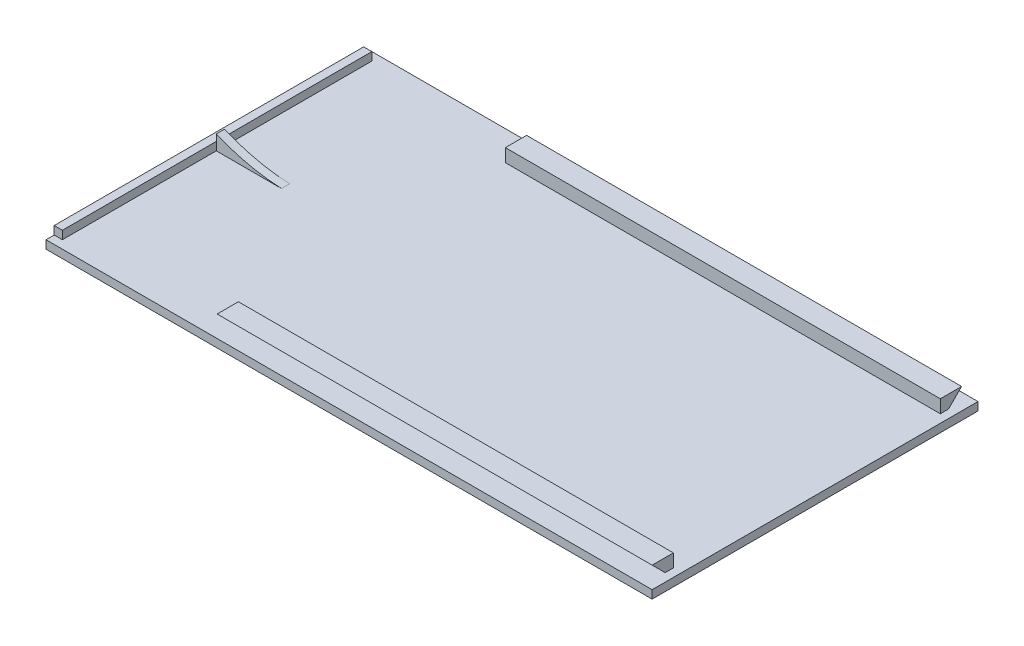
from build123d import *

# Parameters (mm, degrees)
ESBO_O1_W                = 93
ESBO_O1_H                = 50
RESSALTO_EXTRUS_O1_DEPTH = 1.26
ESBO_O2_W                = 1.26
ESBO_O2_H                = 47.48
RESSALTO_EXTRUS_O2_DEPTH = 1.26
ESBO_O3_W                = 10
ESBO_O3_H                = 1.26
RESSALTO_EXTRUS_O3_DEPTH = 2.26
CORTE_EXTRUS_O1_DEPTH    = 1.26
ESBO_O5_W                = 66.74
ESBO_O5_H                = 3.26
RESSALTO_EXTRUS_O4_DEPTH = 2
CORTE_EXTRUS_O3_DEPTH    = 72


with BuildPart() as part:
    # Esboço1 → Ressalto-extrusão1 (new body)
    with BuildSketch(Plane(origin=(0, 0, 0), x_dir=(1, 0, 0), z_dir=(0, 1, 0))):
        with Locations((46.5, 25)):
            Rectangle(ESBO_O1_W, ESBO_O1_H)
    extrude(amount=RESSALTO_EXTRUS_O1_DEPTH)

    # Esboço2 → Ressalto-extrusão2 (add)
    with BuildSketch(Plane(origin=(0, 1.26, 0), x_dir=(1, 0, 0), z_dir=(0, 1, 0))):
        with Locations((0.63, 25)):
            Rectangle(ESBO_O2_W, ESBO_O2_H)
    extrude(amount=RESSALTO_EXTRUS_O2_DEPTH)

    # Esboço3 → Ressalto-extrusão3 (add)
    with BuildSketch(Plane(origin=(0, 1.26, 0), x_dir=(1, 0, 0), z_dir=(0, 1, 0))):
        with Locations((6.26, 25.5)):
            Rectangle(ESBO_O3_W, ESBO_O3_H)
    extrude(amount=RESSALTO_EXTRUS_O3_DEPTH)

    # Esboço4 → Corte-extrusão1 (cut)
    with BuildSketch(Plane.XY.offset(-24.87)):
        with BuildLine():
            Line((1.26, 3.52), (11.26, 3.52))
            Line((11.26, 3.52), (11.26, 1.26))
            ThreePointArc((11.26, 1.26), (6.158122993, 1.939216781), (1.26, 3.52))
        make_face()
    extrude(amount=-CORTE_EXTRUS_O1_DEPTH, mode=Mode.SUBTRACT)

    # Esboço5 → Ressalto-extrusão4 (add)
    with BuildSketch(Plane(origin=(0, 1.26, 0), x_dir=(1, 0, 0), z_dir=(0, 1, 0))):
        with Locations((58.37, 2.89)):
            Rectangle(ESBO_O5_W, ESBO_O5_H)
        with Locations((58.37, 47.11)):
            Rectangle(ESBO_O5_W, ESBO_O5_H)
    extrude(amount=RESSALTO_EXTRUS_O4_DEPTH)

    # Esboço6 → Corte-extrusão3 (cut)
    with BuildSketch(Plane(origin=(91.74, 0, 0), x_dir=(0, 0, -1), z_dir=(1, 0, 0))):
        Polygon((3.262223764, 1.26), (1.26, 3.26), (1.26, 1.26), align=None)
        Polygon((46.737776236, 1.26), (48.74, 3.26), (48.74, 1.26), align=None)
    extrude(amount=-CORTE_EXTRUS_O3_DEPTH, mode=Mode.SUBTRACT)


solid = part.part
